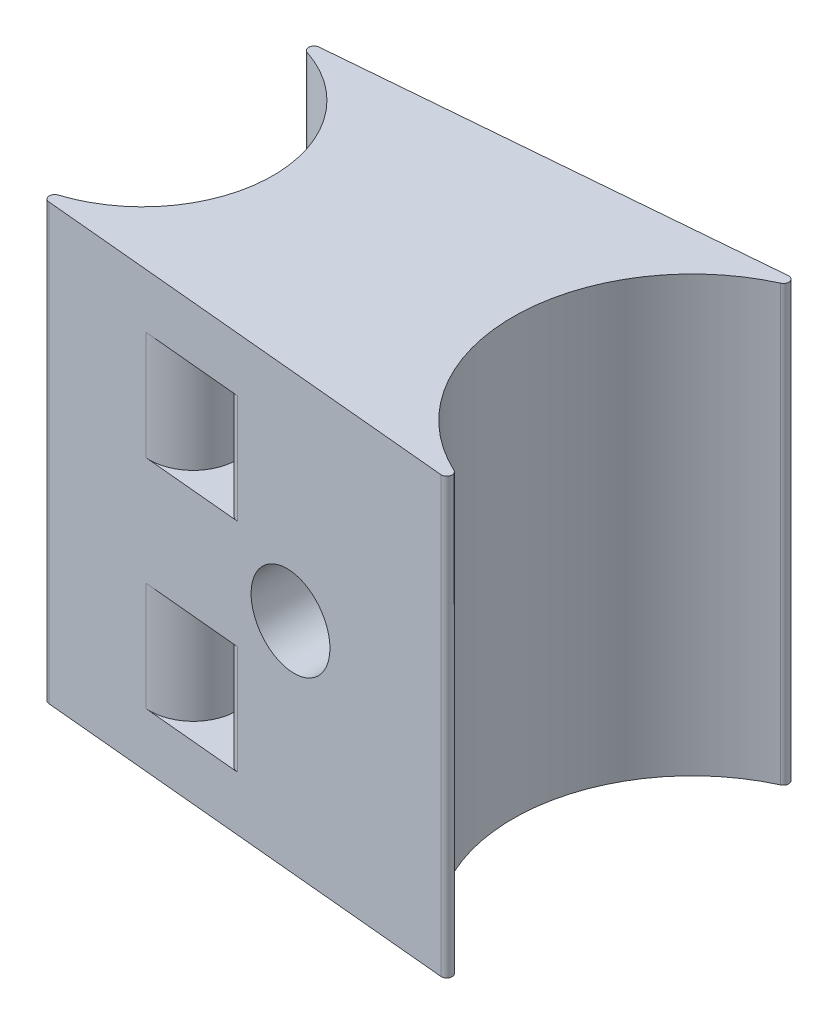
from build123d import *

# Parameters (mm, degrees)
BOSS_EXTRUDE1_DEPTH     = 20
CUT_EXTRUDE1_DEPTH      = 31.882754065
CUT_EXTRUDE1_DEPTH_BACK = 31.882754065
SKETCH2_R               = 2
SKETCH2_W               = 2
SKETCH2_H               = 5
FILLET1_R               = 2
FILLET2_R               = 0.5


with BuildPart() as part:
    # Sketch1 → Boss-Extrude1 (new body)
    with BuildSketch(Plane(origin=(0, 0, 0), x_dir=(1, 0, 0), z_dir=(0, 1, 0))):
        with BuildLine():
            Line((1.933321902, 6.18565004), (21.840134803, 7.875133355))
            ThreePointArc((21.840134803, 7.875133355), (22.103064319, 7.689578117), (21.96535024, 7.398721607))
            ThreePointArc((21.96535024, 7.398721607), (17.149860581, -0.069152491), (21.904969991, -7.575617618))
            ThreePointArc((21.904969991, -7.575617618), (22.040334019, -7.867575246), (21.775916667, -8.051004091))
            Line((21.775916667, -8.051004091), (1.883375697, -6.201039912))
            ThreePointArc((1.883375697, -6.201039912), (1.657998799, -5.979217339), (1.830264266, -5.714029464))
            ThreePointArc((1.830264266, -5.714029464), (5.999951224, -0.024193291), (1.876284769, 5.699083739))
            ThreePointArc((1.876284769, 5.699083739), (1.706163475, 5.965652202), (1.933321902, 6.18565004))
        make_face()
    extrude(amount=BOSS_EXTRUDE1_DEPTH)

    # Sketch2 → Cut-Extrude1 (cut, two sides: drawn at the far end of the back side and taken through both)
    with BuildSketch(Plane.XY.offset(-CUT_EXTRUDE1_DEPTH_BACK)):
        with Locations((14.149793513, 10)):
            Circle(SKETCH2_R)
        with Locations((10, 15)):
            Rectangle(SKETCH2_W, SKETCH2_H)
        with Locations((10, 5)):
            Rectangle(SKETCH2_W, SKETCH2_H)
    extrude(amount=CUT_EXTRUDE1_DEPTH + CUT_EXTRUDE1_DEPTH_BACK, mode=Mode.SUBTRACT)

    # Fillet1
    fillet1_edges = [part.edges().sort_by_distance(p)[0] for p in [
        (9, 5, 6.862870899),
        (9, 15, 6.862870899),
        (9, 15, -6.785396207),
        (9, 5, -6.785396207),
    ]]
    fillet(fillet1_edges, radius=FILLET1_R)

    # Fillet2
    fillet2_edges = [part.edges().sort_by_distance(p)[0] for p in [
        (11, 5, 7.048866663),
        (11, 15, 7.048866663),
        (11, 15, -6.955135414),
        (11, 5, -6.955135414),
    ]]
    fillet(fillet2_edges, radius=FILLET2_R)


solid = part.part
